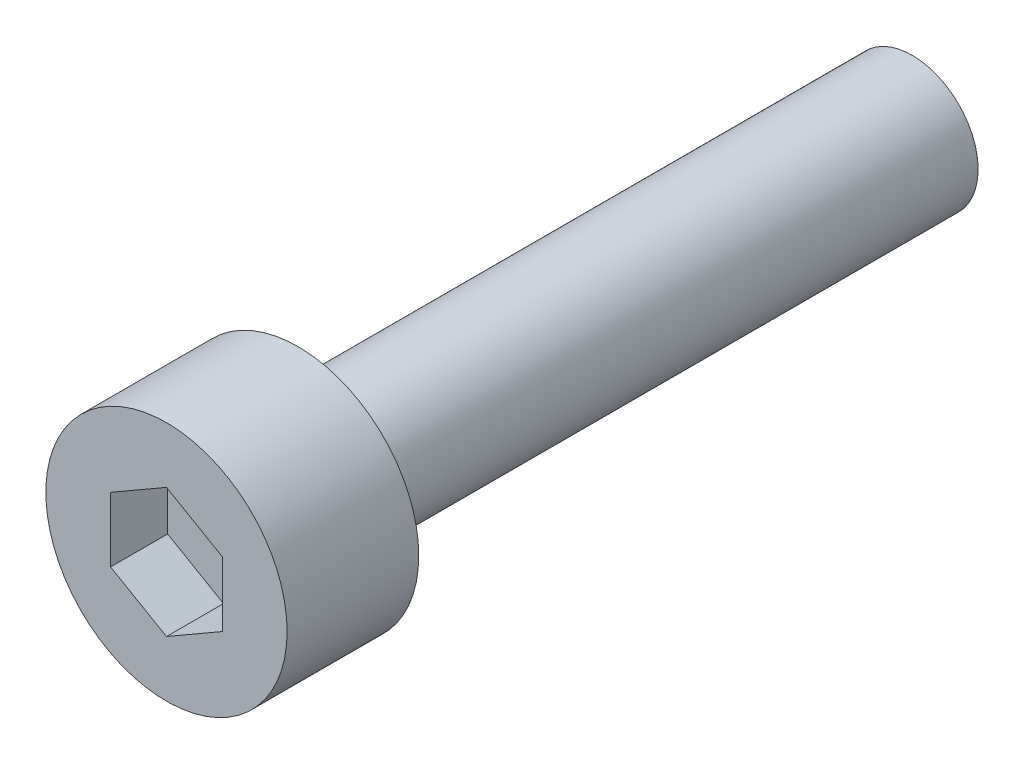
from build123d import *

# Parameters (mm, degrees)
SKETCH_1_R          = 2.75
EXTRUDE_1_DEPTH     = 3
CUT_EXTRUDE_1_DEPTH = 1.3
SKETCH_3_R          = 1.5
EXTRUDE_2_DEPTH     = 14


with BuildPart() as part:
    # 草图1 → 凸台-拉伸1 (new body)
    with BuildSketch(Plane.XY):
        Circle(SKETCH_1_R)
    extrude(amount=EXTRUDE_1_DEPTH)

    # 草图2 → 切除-拉伸1 (cut)
    with BuildSketch(Plane.XY.offset(3)):
        Polygon((1.275, -0.736121593), (1.275, 0.736121593), (0, 1.472243186), (-1.275, 0.736121593), (-1.275, -0.736121593), (0, -1.472243186), align=None)
    extrude(amount=-CUT_EXTRUDE_1_DEPTH, mode=Mode.SUBTRACT)

    # 草图3 → 凸台-拉伸2 (add)
    with BuildSketch(Plane(origin=(0, 0, 0), x_dir=(-1, 0, 0), z_dir=(0, 0, -1))):
        Circle(SKETCH_3_R)
    extrude(amount=EXTRUDE_2_DEPTH)


solid = part.part
